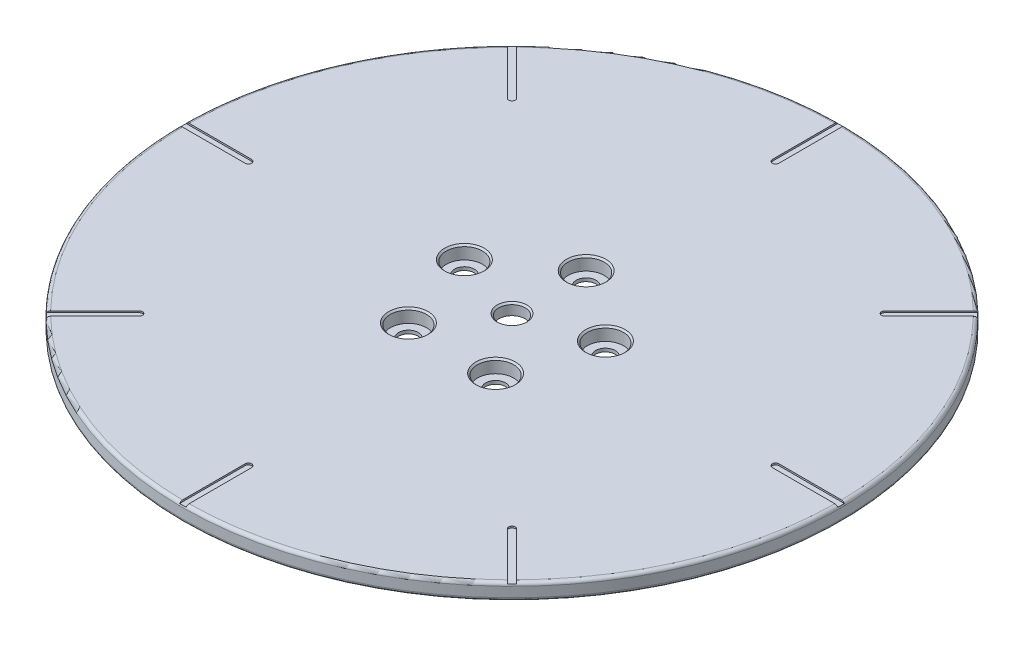
from build123d import *

# Parameters (mm, degrees)
SKICA1_W                 = 96
SKICA1_H                 = 5
SKICA2_R                 = 3
ODEBRAT_VYSUNUT_M1_DEPTH = 5
ZAOBLIT1_R               = 1
SKICA3_R                 = 5.5
ODEBRAT_VYSUNUT_M2_DEPTH = 4
ZKOSEN_2_SIZE            = 0.5
SKICA4_R                 = 9
ODEBRAT_VYSUNUT_M3_DEPTH = 1.6
ZKOSEN_3_SIZE            = 0.5
SKICA5_W                 = 5
SKICA5_H                 = 5
P_IDAT_VYSUNUT_M1_DEPTH  = 10
ZKOSEN_8_SIZE            = 1
ODEBRAT_VYSUNUT_M4_DEPTH = 0.5


with BuildPart() as part:
    # Skica1 → Rotovat1 (revolve)
    with BuildSketch(Plane.XY, mode=Mode.PRIVATE) as rotovat1_sk:
        with Locations((-52, 2.5)):
            Rectangle(SKICA1_W, SKICA1_H)
    revolve(rotovat1_sk.sketch.rotate(Axis((0, 0, 0), (0, 1, 0)), 270), axis=Axis((0, 0, 0), (0, 1, 0)))

    # Skica2 → Odebrat vysunutím1 (cut)
    with BuildSketch(Plane(origin=(0, 5, 0), x_dir=(1, 0, 0), z_dir=(0, 1, 0))):
        with Locations(Location((0, 22.5, 0), (0, 0, 270))):
            Circle(SKICA2_R)
        with Locations(Location((21.398771617, 6.952882373, 0), (0, 0, 270))):
            Circle(SKICA2_R)
        with Locations(Location((13.225168177, -18.202882373, 0), (0, 0, 270))):
            Circle(SKICA2_R)
        with Locations(Location((-13.225168177, -18.202882373, 0), (0, 0, 270))):
            Circle(SKICA2_R)
        with Locations(Location((-21.398771617, 6.952882373, 0), (0, 0, 270))):
            Circle(SKICA2_R)
    extrude(amount=-ODEBRAT_VYSUNUT_M1_DEPTH, mode=Mode.SUBTRACT)

    # Zaoblit1
    zaoblit1_edges = [part.edges().sort_by_distance(p)[0] for p in [
        (0, 0, 100),
        (0, 5, 100),
    ]]
    fillet(zaoblit1_edges, radius=ZAOBLIT1_R)

    # Skica3 → Odebrat vysunutím2 (cut)
    with BuildSketch(Plane(origin=(0, 5, 0), x_dir=(1, 0, 0), z_dir=(0, 1, 0))):
        with Locations(Location((0, 22.5, 0), (0, 0, 270))):
            Circle(SKICA3_R)
        with Locations(Location((21.398771617, 6.952882373, 0), (0, 0, 270))):
            Circle(SKICA3_R)
        with Locations(Location((13.225168177, -18.202882373, 0), (0, 0, 270))):
            Circle(SKICA3_R)
        with Locations(Location((-13.225168177, -18.202882373, 0), (0, 0, 270))):
            Circle(SKICA3_R)
        with Locations(Location((-21.398771617, 6.952882373, 0), (0, 0, 270))):
            Circle(SKICA3_R)
    extrude(amount=-ODEBRAT_VYSUNUT_M2_DEPTH, mode=Mode.SUBTRACT)

    # Zkosení2
    zkosen_2_edges = [part.edges().sort_by_distance(p)[0] for p in [
        (0, 5, -28),
        (21.398771617, 5, -12.452882373),
        (13.225168177, 5, 12.702882373),
        (-13.225168177, 5, 12.702882373),
        (-21.398771617, 5, -12.452882373),
    ]]
    chamfer(zkosen_2_edges, length=ZKOSEN_2_SIZE)

    # Skica4 → Odebrat vysunutím3 (cut)
    with BuildSketch(Plane.XZ):
        with Locations(Location((0, 0, 0), (0, 0, 270))):
            Circle(SKICA4_R)
    extrude(amount=-ODEBRAT_VYSUNUT_M3_DEPTH, mode=Mode.SUBTRACT)

    # Zkosení3
    zkosen_3_edges = [part.edges().sort_by_distance(p)[0] for p in [
        (0, 5, 4),
    ]]
    chamfer(zkosen_3_edges, length=ZKOSEN_3_SIZE)

    # Skica5 → Přidat vysunutím1 (add)
    with BuildSketch(Plane.XZ):
        with Locations((-60, 0)):
            Rectangle(SKICA5_W, SKICA5_H)
    extrude(amount=P_IDAT_VYSUNUT_M1_DEPTH)

    # Zkosení8
    zkosen_8_edges = [part.edges().sort_by_distance(p)[0] for p in [
        (-57.5, 0, 0),
        (-60, 0, 2.5),
        (-62.5, 0, 0),
        (-60, 0, -2.5),
        (-57.5, -10, 0),
        (-60, -10, 2.5),
        (-62.5, -10, 0),
        (-60, -10, -2.5),
    ]]
    chamfer(zkosen_8_edges, length=ZKOSEN_8_SIZE)

    # Skica6 → Odebrat vysunutím4 (cut)
    with BuildSketch(Plane(origin=(0, 5, 0), x_dir=(1, 0, 0), z_dir=(0, 1, 0))):
        with BuildLine():
            Line((-104.877493729, 1), (-80, 1))
            ThreePointArc((-80, 1), (-79, 0), (-80, -1))
            Line((-80, -1), (-104.877493729, -1))
            ThreePointArc((-104.877493729, -1), (-105.877493729, 0), (-104.877493729, 1))
        make_face()
        with BuildLine():
            Line((-73.452480229, 74.866693791), (-55.861435714, 57.275649276))
            ThreePointArc((-55.861435714, 57.275649276), (-55.861435714, 55.861435714), (-57.275649276, 55.861435714))
            Line((-57.275649276, 55.861435714), (-74.866693791, 73.452480229))
            ThreePointArc((-74.866693791, 73.452480229), (-74.866693791, 74.866693791), (-73.452480229, 74.866693791))
        make_face()
        with BuildLine():
            Line((1, 104.877493729), (1, 80))
            ThreePointArc((1, 80), (0, 79), (-1, 80))
            Line((-1, 80), (-1, 104.877493729))
            ThreePointArc((-1, 104.877493729), (0, 105.877493729), (1, 104.877493729))
        make_face()
        with BuildLine():
            Line((74.866693791, 73.452480229), (57.275649276, 55.861435714))
            ThreePointArc((57.275649276, 55.861435714), (55.861435714, 55.861435714), (55.861435714, 57.275649276))
            Line((55.861435714, 57.275649276), (73.452480229, 74.866693791))
            ThreePointArc((73.452480229, 74.866693791), (74.866693791, 74.866693791), (74.866693791, 73.452480229))
        make_face()
        with BuildLine():
            Line((104.877493729, -1), (80, -1))
            ThreePointArc((80, -1), (79, 0), (80, 1))
            Line((80, 1), (104.877493729, 1))
            ThreePointArc((104.877493729, 1), (105.877493729, 0), (104.877493729, -1))
        make_face()
        with BuildLine():
            Line((73.452480229, -74.866693791), (55.861435714, -57.275649276))
            ThreePointArc((55.861435714, -57.275649276), (55.861435714, -55.861435714), (57.275649276, -55.861435714))
            Line((57.275649276, -55.861435714), (74.866693791, -73.452480229))
            ThreePointArc((74.866693791, -73.452480229), (74.866693791, -74.866693791), (73.452480229, -74.866693791))
        make_face()
        with BuildLine():
            Line((-1, -104.877493729), (-1, -80))
            ThreePointArc((-1, -80), (0, -79), (1, -80))
            Line((1, -80), (1, -104.877493729))
            ThreePointArc((1, -104.877493729), (0, -105.877493729), (-1, -104.877493729))
        make_face()
        with BuildLine():
            Line((-74.866693791, -73.452480229), (-57.275649276, -55.861435714))
            ThreePointArc((-57.275649276, -55.861435714), (-55.861435714, -55.861435714), (-55.861435714, -57.275649276))
            Line((-55.861435714, -57.275649276), (-73.452480229, -74.866693791))
            ThreePointArc((-73.452480229, -74.866693791), (-74.866693791, -74.866693791), (-74.866693791, -73.452480229))
        make_face()
    extrude(amount=-ODEBRAT_VYSUNUT_M4_DEPTH, mode=Mode.SUBTRACT)


solid = part.part
